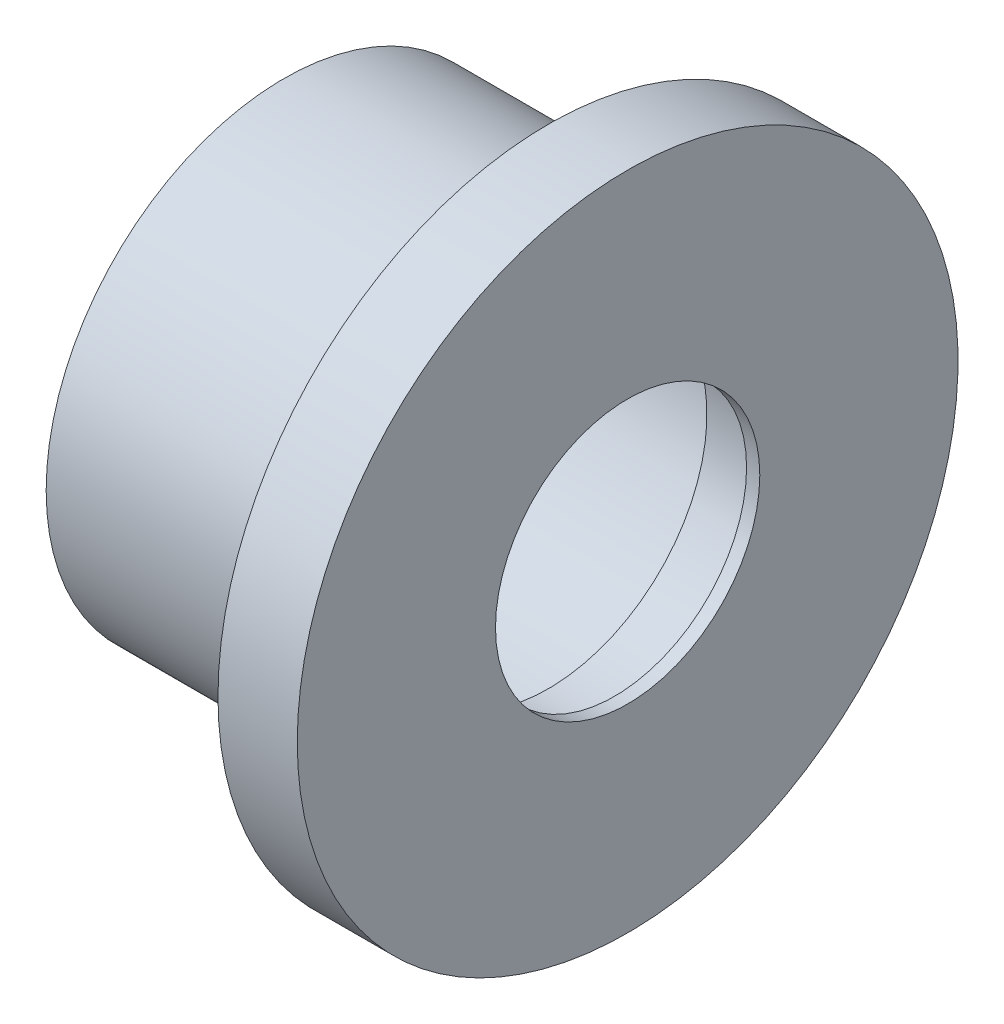
from build123d import *


with BuildPart() as part:
    # Sketch1 → Revolve1 (revolve)
    with BuildSketch(Plane.XY, mode=Mode.PRIVATE) as revolve1_sk:
        Polygon((-1, 12), (-6, 12), (-6, 16), (-26, 16), (-26, 18), (-6, 18), (-6, 25), (0, 25), (0, 10), (-1, 10), align=None)
    revolve(revolve1_sk.sketch.rotate(Axis((-42.809570876, 0, 0), (1, 0, 0)), 90), axis=Axis((-42.809570876, 0, 0), (1, 0, 0)))


solid = part.part
